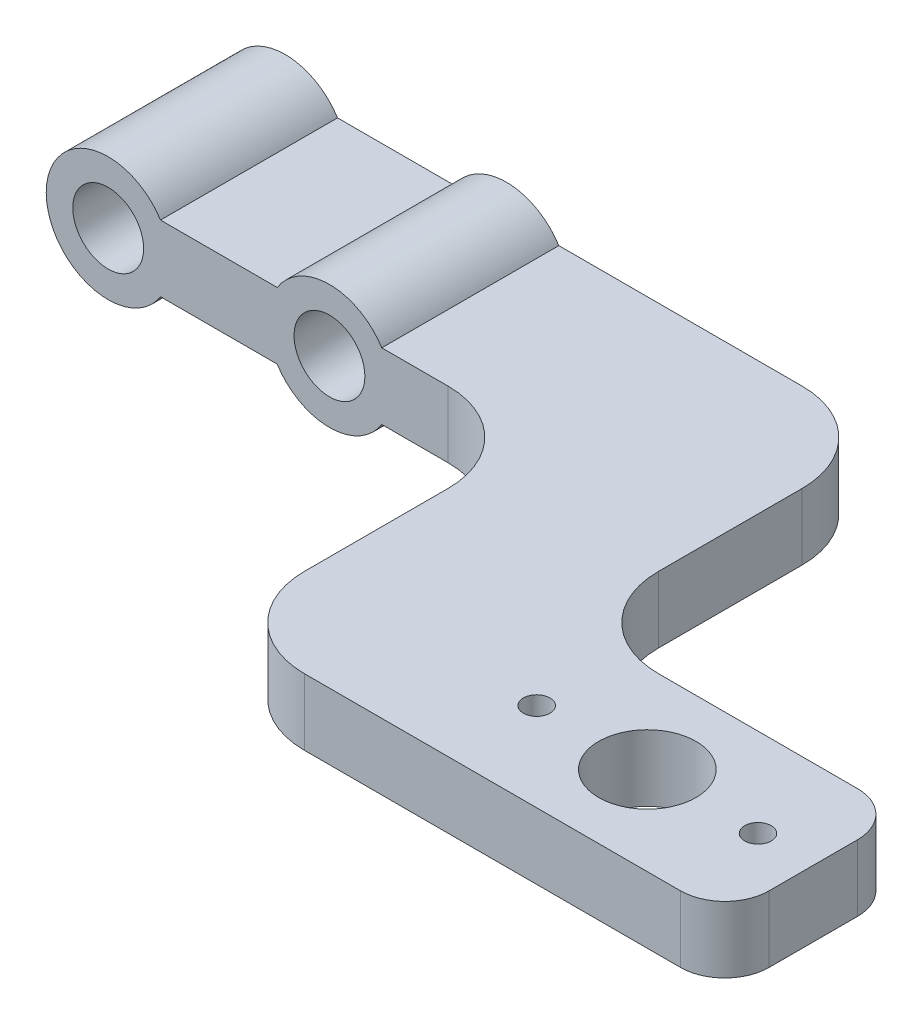
from build123d import *

# Parameters (mm, degrees)
SKETCH_1_W               = 15
SKETCH_1_H               = 8
SKETCH_1_R               = 2.2
SKETCH_1_R_2             = 0.6
EXTRUDE_1_DEPTH          = 3
FILLET_1_R               = 2
SKETCH_2_R               = 1.6
EXTRUDE_2_DEPTH          = 22.5
CUT_EXTRUDE_1_DEPTH      = 43.182233899
CUT_EXTRUDE_1_DEPTH_BACK = 43.182233899
SKETCH_3_W               = 22.164318084
SKETCH_3_H               = 14.5
FILLET_2_R               = 4


with BuildPart() as part:
    # 草图1 → 凸台-拉伸1 (new body)
    with BuildSketch(Plane(origin=(0, 0, 0), x_dir=(1, 0, 0), z_dir=(0, 1, 0))):
        Rectangle(SKETCH_1_W, SKETCH_1_H)
        with Locations(Location((0, 0, 0), (0, 0, 270))):
            Circle(SKETCH_1_R, mode=Mode.SUBTRACT)
        with Locations(Location((-5, 0, 0), (0, 0, 270))):
            Circle(SKETCH_1_R_2, mode=Mode.SUBTRACT)
        with Locations(Location((5, 0, 0), (0, 0, 90))):
            Circle(SKETCH_1_R_2, mode=Mode.SUBTRACT)
    extrude(amount=EXTRUDE_1_DEPTH)

    # 圆角1
    fillet_1_edges = [part.edges().sort_by_distance(p)[0] for p in [
        (7.5, 1.5, 4),
        (7.5, 1.5, -4),
    ]]
    fillet(fillet_1_edges, radius=FILLET_1_R)

    # 草图2 → 凸台-拉伸2 (add)
    with BuildSketch(Plane.XY.offset(4)):
        with BuildLine():
            Line((-7.5, 0), (-7.5, 3))
            Line((-7.5, 3), (-22.5, 3))
            ThreePointArc((-22.5, 3), (-24.864318084, 4.3), (-27.228636167, 3))
            Line((-27.228636167, 3), (-32.5, 3))
            ThreePointArc((-32.5, 3), (-37.664318084, 1.5), (-32.5, 0))
            Line((-32.5, 0), (-27.228636167, 0))
            ThreePointArc((-27.228636167, 0), (-24.864318084, -1.3), (-22.5, 0))
            Line((-22.5, 0), (-7.5, 0))
        make_face()
        with Locations((-24.864318084, 1.5)):
            Circle(SKETCH_2_R, mode=Mode.SUBTRACT)
        with Locations((-34.864318084, 1.5)):
            Circle(SKETCH_2_R, mode=Mode.SUBTRACT)
    extrude(amount=-EXTRUDE_2_DEPTH)

    # 草图3 → 切除-拉伸1 (cut, two sides: drawn at the far end of the back side and taken through both)
    with BuildSketch(Plane(origin=(0, 3, 0), x_dir=(1, 0, 0), z_dir=(0, 1, 0)).offset(-CUT_EXTRUDE_1_DEPTH_BACK)):
        with Locations((-26.582159042, 3.25)):
            Rectangle(SKETCH_3_W, SKETCH_3_H)
    extrude(amount=CUT_EXTRUDE_1_DEPTH + CUT_EXTRUDE_1_DEPTH_BACK, mode=Mode.SUBTRACT)

    # 圆角2
    fillet_2_edges = [part.edges().sort_by_distance(p)[0] for p in [
        (-7.5, 1.5, -18.5),
        (-15.5, 1.5, -10.5),
        (-7.5, 1.5, -4),
        (-15.5, 1.5, 4),
    ]]
    fillet(fillet_2_edges, radius=FILLET_2_R)


solid = part.part
